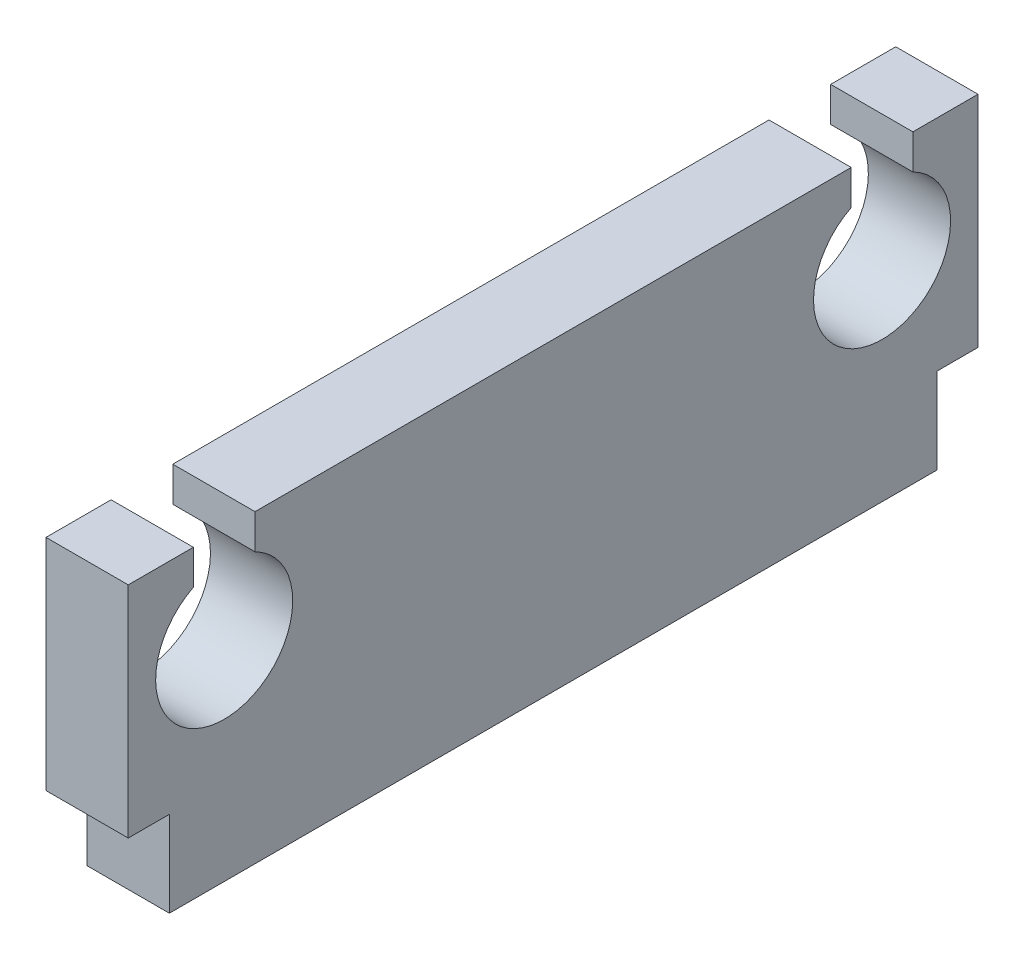
from build123d import *

# Parameters (mm, degrees)
SKETCH1_W           = 6
SKETCH1_H           = 56
BOSS_EXTRUDE1_DEPTH = 22.25
SKETCH6_W           = 6
SKETCH6_H           = 16
BOSS_EXTRUDE3_DEPTH = 3
CUT_EXTRUDE1_DEPTH  = 6


with BuildPart() as part:
    # Sketch1 → Boss-Extrude1 (new body)
    with BuildSketch(Plane(origin=(0, 0, 0), x_dir=(1, 0, 0), z_dir=(0, 1, 0))):
        with Locations((3, 28)):
            Rectangle(SKETCH1_W, SKETCH1_H)
    extrude(amount=BOSS_EXTRUDE1_DEPTH)

    # Sketch6 → Boss-Extrude3 (add)
    with BuildSketch(Plane(origin=(0, 0, -56), x_dir=(-1, 0, 0), z_dir=(0, 0, -1))):
        with Locations((-3, 14.25)):
            Rectangle(SKETCH6_W, SKETCH6_H)
    boss_extrude3 = extrude(amount=BOSS_EXTRUDE3_DEPTH)

    # Mirror3: Boss-Extrude3 across plane
    add(boss_extrude3.mirror(Plane(origin=(0, 0, -28), x_dir=(1, 0, 0), z_dir=(0, 0, -1))))

    # Sketch7 → Cut-Extrude1 (cut)
    with BuildSketch(Plane.ZY):
        with BuildLine():
            Line((-54.25, 19.715142775), (-54.25, 24.715142775))
            Line((-54.25, 24.715142775), (-49.75, 24.715142775))
            Line((-49.75, 24.715142775), (-49.75, 19.715142775))
            ThreePointArc((-49.75, 19.715142775), (-52, 10.25), (-54.25, 19.715142775))
        make_face()
        with BuildLine():
            Line((-6.25, 19.715142775), (-6.25, 24.715142775))
            Line((-6.25, 24.715142775), (-1.75, 24.715142775))
            Line((-1.75, 24.715142775), (-1.75, 19.715142775))
            ThreePointArc((-1.75, 19.715142775), (-4, 10.25), (-6.25, 19.715142775))
        make_face()
    extrude(amount=-CUT_EXTRUDE1_DEPTH, mode=Mode.SUBTRACT)


solid = part.part
